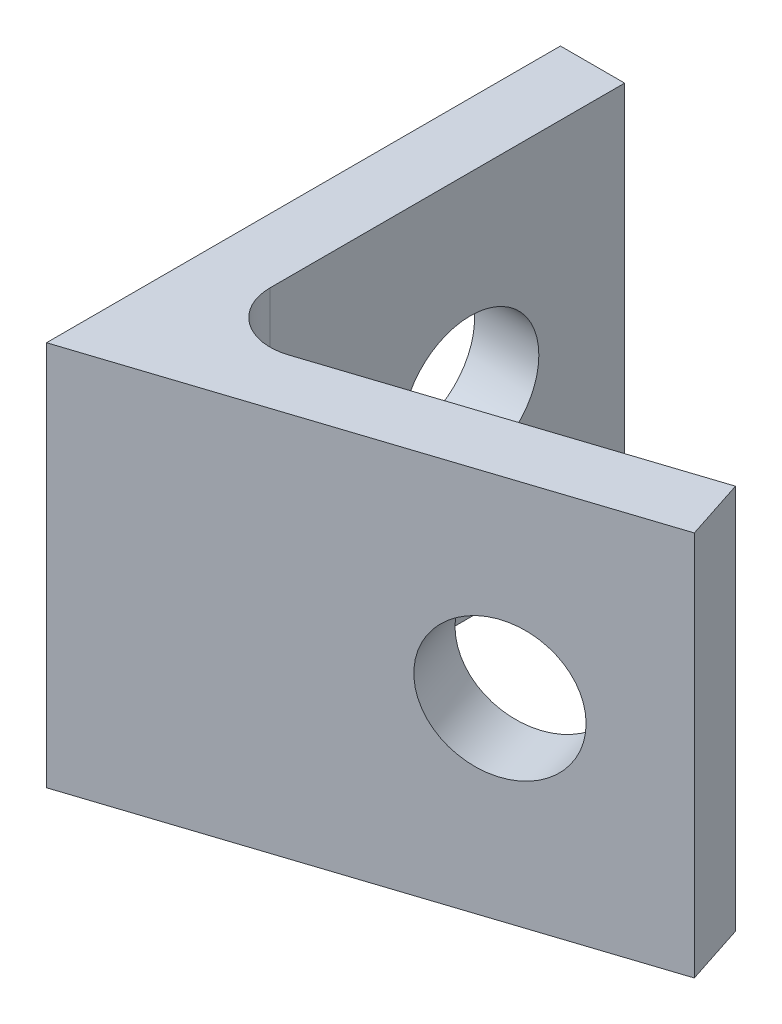
from build123d import *

# Parameters (mm, degrees)
BOSS_EXTRUDE1_DEPTH     = 19.05
FILLET1_R               = 2.54
F_1_4_CLEARANCE_HOLE1_D = 6.7564
F_1_4_CLEARANCE_HOLE2_D = 6.7564


with BuildPart() as part:
    # Sketch1 → Boss-Extrude1 (new body)
    with BuildSketch(Plane(origin=(0, 0, 0), x_dir=(1, 0, 0), z_dir=(0, 1, 0))):
        Polygon((0, 0), (0, 25.4), (3.175, 25.4), (3.175, 4.373344438), (23.167823374, 10.885429945), (24.151140547, 7.866537377), align=None)
    extrude(amount=BOSS_EXTRUDE1_DEPTH)

    # Fillet1
    fillet1_edges = [part.edges().sort_by_distance(p)[0] for p in [
        (3.175, 9.525, -4.373344438),
    ]]
    fillet(fillet1_edges, radius=FILLET1_R)

    # 1/4 Clearance Hole1 (through all)
    with Locations(Plane.ZY):
        with Locations((-17.78, 9.525)):
            Hole(F_1_4_CLEARANCE_HOLE1_D / 2)

    # 1/4 Clearance Hole2 (through all)
    with Locations(Plane(origin=(0, 0, 0), x_dir=(0.9508323049826902, 0, -0.30970619593625254), z_dir=(0.30970619593625254, 0, 0.9508323049826902))):
        with Locations((17.78, 9.525)):
            Hole(F_1_4_CLEARANCE_HOLE2_D / 2)


solid = part.part
